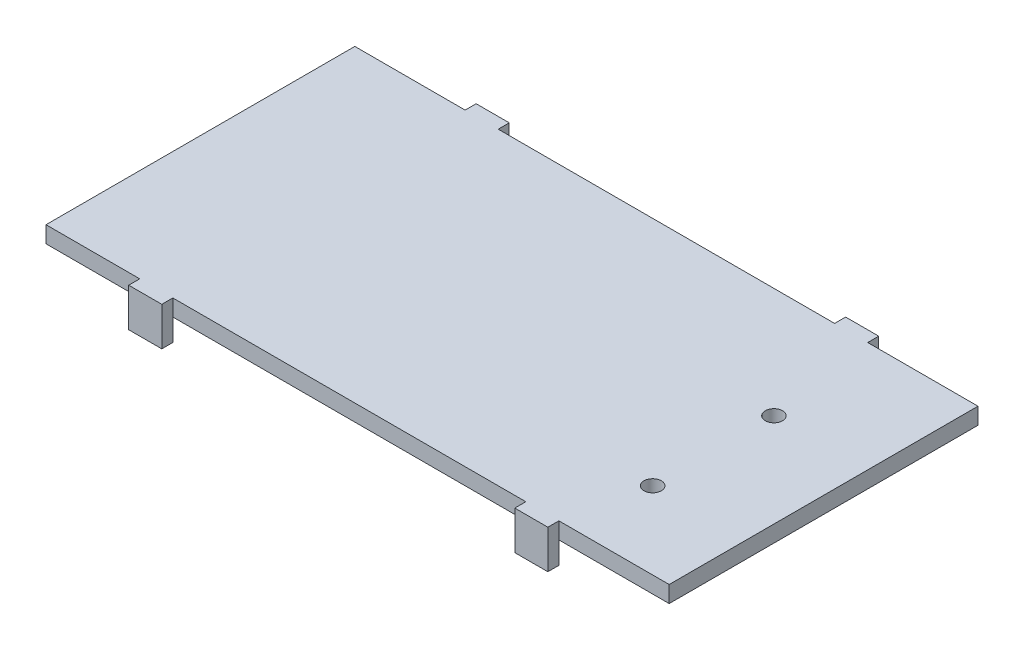
from build123d import *

# Parameters (mm, degrees)
SKETCH1_W           = 143.51
SKETCH1_H           = 71.12
BOSS_EXTRUDE1_DEPTH = 3.81
SKETCH2_W           = 7.62
SKETCH2_H           = 2.54
BOSS_EXTRUDE3_DEPTH = 8.89
SKETCH5_R           = 2
CUT_EXTRUDE2_DEPTH  = 90.125877794


with BuildPart() as part:
    # Sketch1 → Boss-Extrude1 (new body)
    with BuildSketch(Plane(origin=(0, 0, 0), x_dir=(1, 0, 0), z_dir=(0, 1, 0))):
        with Locations((-3.577228739, -9.256847507)):
            Rectangle(SKETCH1_W, SKETCH1_H)
    extrude(amount=BOSS_EXTRUDE1_DEPTH)

    # Sketch2 → Boss-Extrude3 (add)
    with BuildSketch(Plane(origin=(0, 3.81, 0), x_dir=(1, 0, 0), z_dir=(0, 1, 0))):
        with Locations((-46.122228739, 27.573152493)):
            Rectangle(SKETCH2_W, SKETCH2_H)
        with Locations((38.967771261, 27.573152493)):
            Rectangle(SKETCH2_W, SKETCH2_H)
        with Locations((-49.932228739, -46.086847507)):
            Rectangle(SKETCH2_W, SKETCH2_H)
        with Locations((38.967771261, -46.086847507)):
            Rectangle(SKETCH2_W, SKETCH2_H)
    extrude(amount=-BOSS_EXTRUDE3_DEPTH)

    # Sketch5 → Cut-Extrude2 (cut, through all)
    with BuildSketch(Plane(origin=(0, 0, 0), x_dir=(-1, 0, 0), z_dir=(0, -1, 0))):
        with Locations(Location((-46.587771261, -27.036847507, 0), (0, 0, 90))):
            Circle(SKETCH5_R)
        with Locations(Location((-46.587771261, 0.903152493, 0), (0, 0, 90))):
            Circle(SKETCH5_R)
    extrude(amount=-CUT_EXTRUDE2_DEPTH, mode=Mode.SUBTRACT)


solid = part.part
